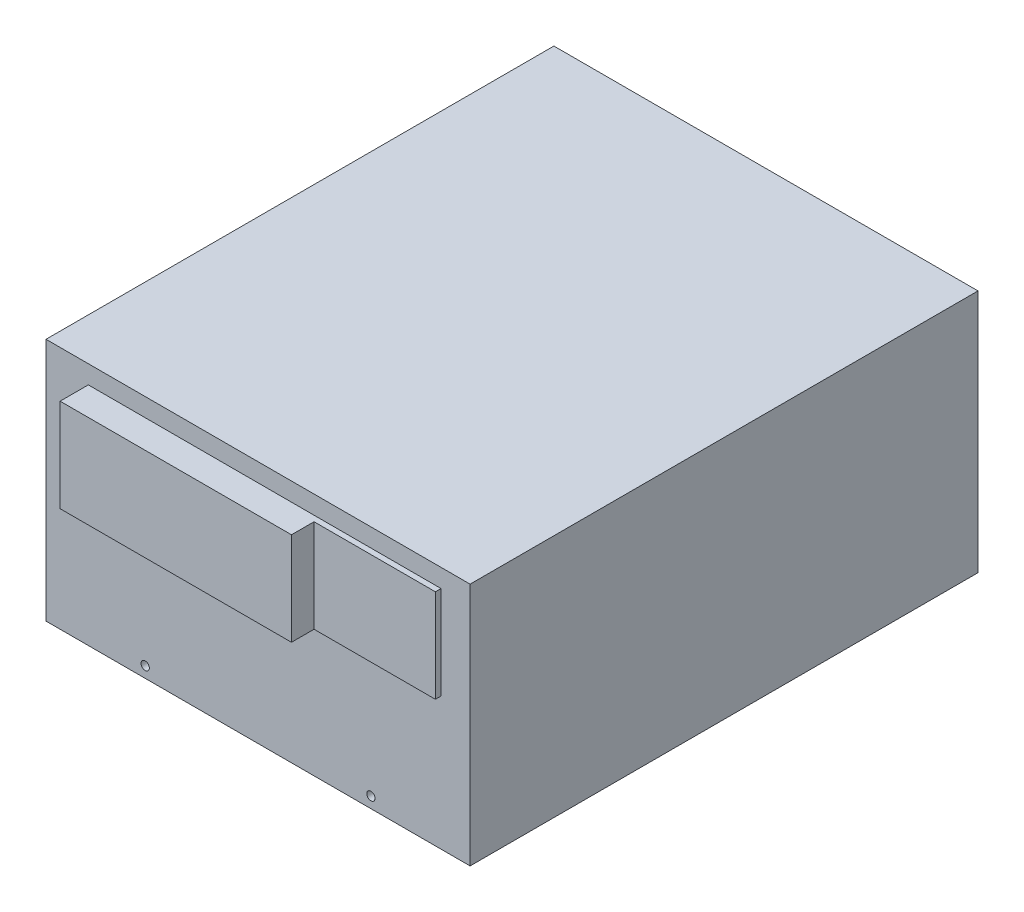
from build123d import *

# Parameters (mm, degrees)
SKETCH1_W           = 150.3
SKETCH1_H           = 86.5
BOSS_EXTRUDE1_DEPTH = 180
SKETCH1_3_R         = 1.47
CUT_EXTRUDE1_DEPTH  = 10
SKETCH1_4_W         = 82
SKETCH1_4_H         = 33
BOSS_EXTRUDE2_DEPTH = 10
SKETCH1_5_W         = 43
SKETCH1_5_H         = 33
BOSS_EXTRUDE3_DEPTH = 2


with BuildPart() as part:
    # Sketch1 → Boss-Extrude1 (new body)
    with BuildSketch(Plane.XY):
        with Locations((75.15, 43.25)):
            Rectangle(SKETCH1_W, SKETCH1_H)
    extrude(amount=-BOSS_EXTRUDE1_DEPTH)

    # Sketch1<3> → Cut-Extrude1 (cut)
    with BuildSketch(Plane.XY):
        with Locations((35.15, 3.89)):
            Circle(SKETCH1_3_R)
        with Locations((115.15, 3.89)):
            Circle(SKETCH1_3_R)
    extrude(amount=-CUT_EXTRUDE1_DEPTH, mode=Mode.SUBTRACT)

    # Sketch1<4> → Boss-Extrude2 (add)
    with BuildSketch(Plane.XY):
        with Locations((56, 63.5)):
            Rectangle(SKETCH1_4_W, SKETCH1_4_H)
    extrude(amount=BOSS_EXTRUDE2_DEPTH)

    # Sketch1<5> → Boss-Extrude3 (add)
    with BuildSketch(Plane.XY):
        with Locations((118.5, 63.5)):
            Rectangle(SKETCH1_5_W, SKETCH1_5_H)
    extrude(amount=BOSS_EXTRUDE3_DEPTH)


solid = part.part
